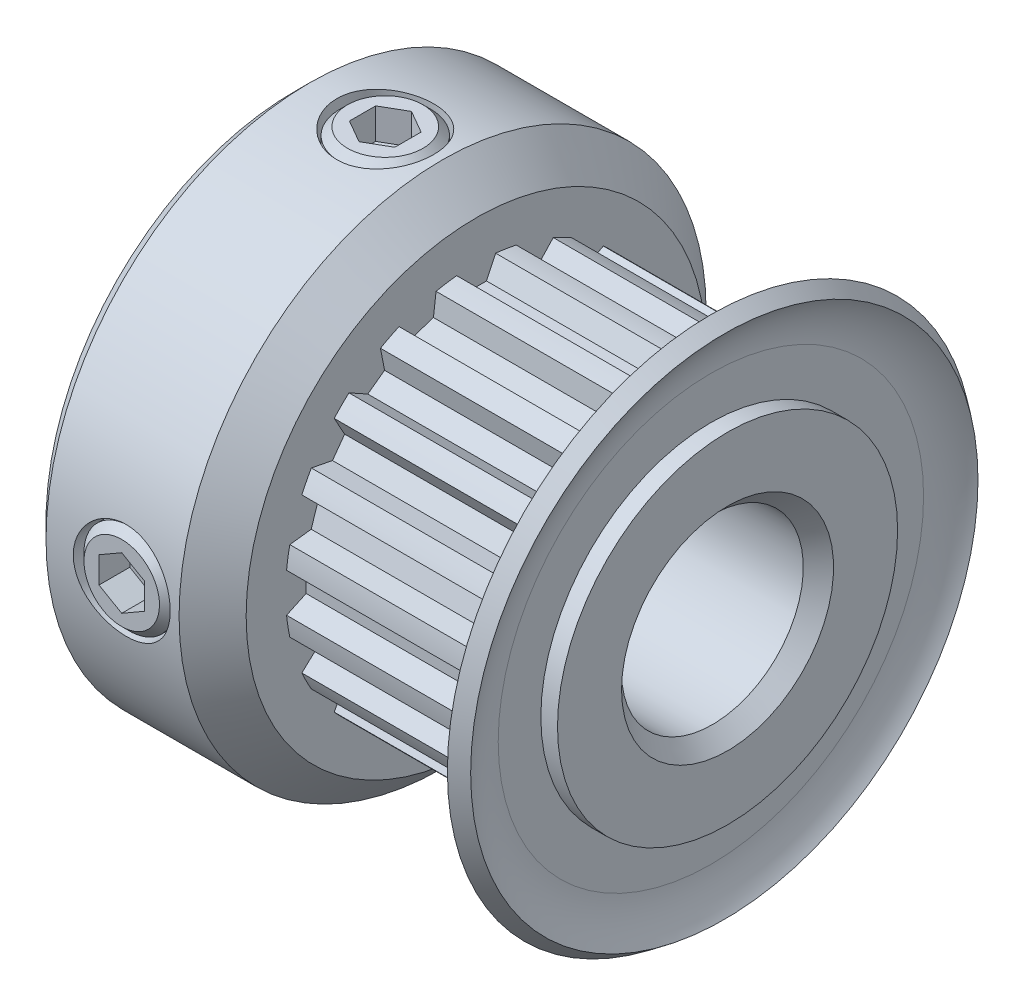
from build123d import *

# Parameters (mm, degrees)
SKETCH4_R          = 6.45
SKETCH4_R_2        = 6.29125
CUT_EXTRUDE2_DEPTH = 7.2
CUT_EXTRUDE1_DEPTH = 7.2
CIRPATTERN1_COUNT  = 20
SKETCH6_R          = 1.6
CUT_EXTRUDE3_DEPTH = 15.230337312
CUT_EXTRUDE4_DEPTH = 1.016
CIRPATTERN2_COUNT  = 2
CIRPATTERN2_ANGLE  = 90
CIRPATTERN3_COUNT  = 2
CIRPATTERN3_ANGLE  = 90
CHAMFER1_SIZE      = 0.5


with BuildPart() as part:
    # Sketch1 → Revolve1 (revolve)
    with BuildSketch(Plane.XY, mode=Mode.PRIVATE) as revolve1_sk:
        with BuildLine():
            Line((-7.15, 3), (7.15, 3))
            Line((7.15, 3), (7.15, 8.7))
            Line((7.15, 8.7), (6.6, 8.7))
            ThreePointArc((6.6, 8.7), (6.19100507, 7.90465659), (6.05, 7.0215))
            Line((6.05, 7.0215), (6.05, 6.45))
            Line((6.05, 6.45), (-1.15, 6.45))
            Line((-1.15, 6.45), (-1.15, 7.593))
            Line((-1.15, 7.593), (-2.257, 8.7))
            Line((-2.257, 8.7), (-7.15, 8.7))
            Line((-7.15, 8.7), (-7.15, 3))
        make_face()
    revolve(revolve1_sk.sketch.rotate(Axis((-7.15, 0, 0), (1, 0, 0)), 90), axis=Axis((-7.15, 0, 0), (1, 0, 0)))

    # Sketch4 → Cut-Extrude2 (cut)
    with BuildSketch(Plane(origin=(-1.15, 0, 0), x_dir=(0, 0, -1), z_dir=(1, 0, 0))):
        Circle(SKETCH4_R)
        Circle(SKETCH4_R_2, mode=Mode.SUBTRACT)
    extrude(amount=CUT_EXTRUDE2_DEPTH, mode=Mode.SUBTRACT)

    # Sketch3 → Cut-Extrude1 (cut)
    with BuildSketch(Plane(origin=(-1.15, 0, 0), x_dir=(0, 0, -1), z_dir=(1, 0, 0))):
        with BuildLine():
            Line((-0.642626263, 6.258343075), (-0.342201625, 5.614080361))
            Line((-0.342201625, 5.614080361), (0.342201625, 5.614080361))
            Line((0.342201625, 5.614080361), (0.642626263, 6.258343075))
            ThreePointArc((0.642626263, 6.258343075), (0, 6.29125), (-0.642626263, 6.258343075))
        make_face()
    cut_extrude1 = extrude(amount=CUT_EXTRUDE1_DEPTH, mode=Mode.SUBTRACT)

    # CirPattern1: Cut-Extrude1 ×20 about axis
    cirpattern1_axis = Axis((0, 0, 0), (1, 0, 0))
    for i in range(1, CIRPATTERN1_COUNT):
        add(cut_extrude1.rotate(cirpattern1_axis, i * 360 / CIRPATTERN1_COUNT), mode=Mode.SUBTRACT)

    # Sketch6 → Cut-Extrude3 (cut, through all)
    with BuildSketch(Plane(origin=(0, 0, 0), x_dir=(1, 0, 0), z_dir=(0, 1, 0))):
        with Locations(Location((-4.15, 0, 0), (0, 0, 90))):
            Circle(SKETCH6_R)
    cut_extrude3 = extrude(amount=CUT_EXTRUDE3_DEPTH, mode=Mode.SUBTRACT)

    # CirPattern2: Cut-Extrude3 ×2 about axis
    cirpattern2_axis = Axis((-7.15, 0, 0), (1, 0, 0))
    for i in range(1, CIRPATTERN2_COUNT):
        add(cut_extrude3.rotate(cirpattern2_axis, i * CIRPATTERN2_ANGLE / (CIRPATTERN2_COUNT - 1)), mode=Mode.SUBTRACT)

    # Chamfer1
    chamfer1_edges = [part.edges().sort_by_distance(p)[0] for p in [
        (-7.15, 0, -8.7),
        (-7.15, 0, -3),
        (7.15, 0, -3),
    ]]
    chamfer(chamfer1_edges, length=CHAMFER1_SIZE)

    # Sketch9 → Cut-Revolve1 (revolve, cut)
    with BuildSketch(Plane.XY, mode=Mode.PRIVATE) as cut_revolve1_sk:
        with BuildLine():
            Line((7.15, 5.614080361), (7.15, 8.7))
            Line((7.15, 8.7), (6.79262822, 8.962373569))
            Line((6.79262822, 8.962373569), (6.6, 8.7))
            Line((6.6, 8.7), (7.04334465, 8.374507264))
            ThreePointArc((7.04334465, 8.374507264), (6.713661534, 7.733395908), (6.6, 7.0215))
            Line((6.6, 7.0215), (6.6, 5.614080361))
            Line((6.6, 5.614080361), (7.15, 5.614080361))
        make_face()
    revolve(cut_revolve1_sk.sketch.rotate(Axis((-7.15, 0, 0), (1, 0, 0)), 90), axis=Axis((-7.15, 0, 0), (1, 0, 0)), mode=Mode.SUBTRACT)


with BuildPart() as body_2:
    # Sketch7 → Revolve2 (revolve)
    with BuildSketch(Plane.XY, mode=Mode.PRIVATE) as revolve2_sk:
        Polygon((-5.396, 8.7), (-4.15, 8.7), (-4.15, 3.381), (-5.396, 3.381), (-5.65, 3.635), (-5.65, 8.446), align=None)
    revolve(revolve2_sk.sketch.rotate(Axis((-4.15, 3.381, 0), (0, 1, 0)), 270), axis=Axis((-4.15, 3.381, 0), (0, 1, 0)))

    # Sketch8 → Cut-Extrude4 (cut)
    with BuildSketch(Plane(origin=(0, 8.7, 0), x_dir=(1, 0, 0), z_dir=(0, 1, 0))):
        Polygon((-4.15, 0.866025404), (-4.9, 0.433012702), (-4.9, -0.433012702), (-4.15, -0.866025404), (-3.4, -0.433012702), (-3.4, 0.433012702), align=None)
    extrude(amount=-CUT_EXTRUDE4_DEPTH, mode=Mode.SUBTRACT)


with BuildPart() as cirpattern3_1:
    # CirPattern3: pattern copy
    add(body_2.part.rotate(Axis((0, 0, 0), (1, 0, 0)), 1 * CIRPATTERN3_ANGLE / (CIRPATTERN3_COUNT - 1)))


solid = Compound([part.part, body_2.part, cirpattern3_1.part])
